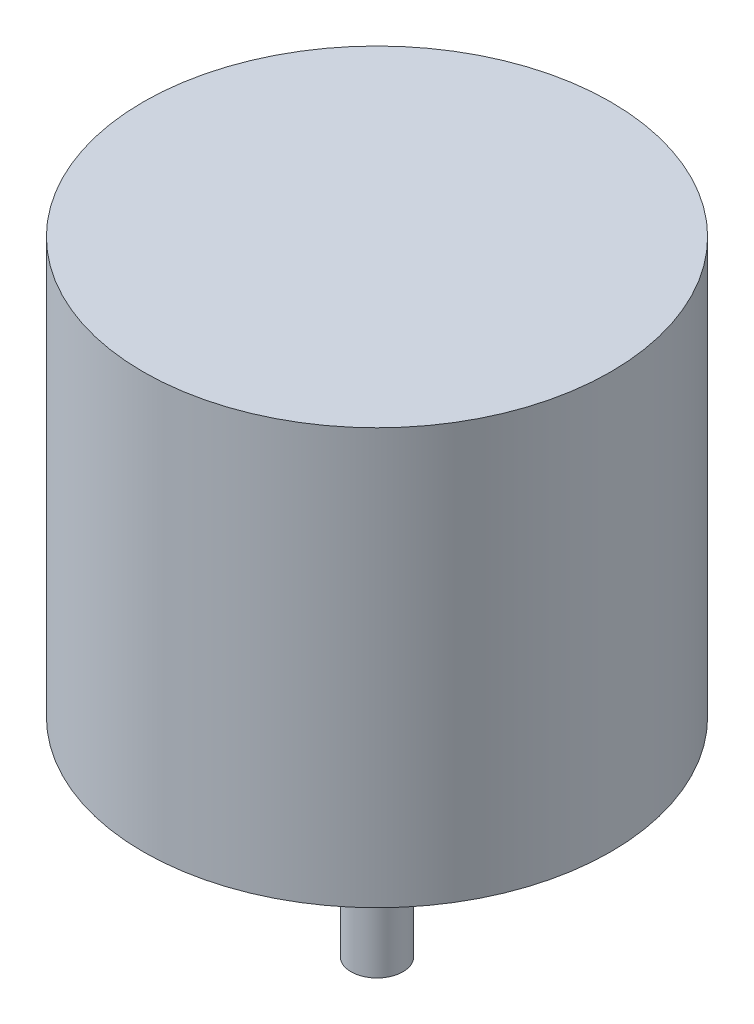
from build123d import *

# Parameters (mm, degrees)
SKETCH1_R           = 28.575
BOSS_EXTRUDE1_DEPTH = 50.8
SKETCH2_R           = 3.175
BOSS_EXTRUDE2_DEPTH = 25.4


with BuildPart() as part:
    # Sketch1 → Boss-Extrude1 (new body)
    with BuildSketch(Plane(origin=(0, 0, 0), x_dir=(1, 0, 0), z_dir=(0, 1, 0))):
        with Locations(Location((0, 0, 0), (0, 0, 270))):
            Circle(SKETCH1_R)
    extrude(amount=BOSS_EXTRUDE1_DEPTH)

    # Sketch2 → Boss-Extrude2 (add)
    with BuildSketch(Plane.XZ):
        with Locations(Location((0, 0, 0), (0, 0, 90))):
            Circle(SKETCH2_R)
    extrude(amount=BOSS_EXTRUDE2_DEPTH)


solid = part.part
